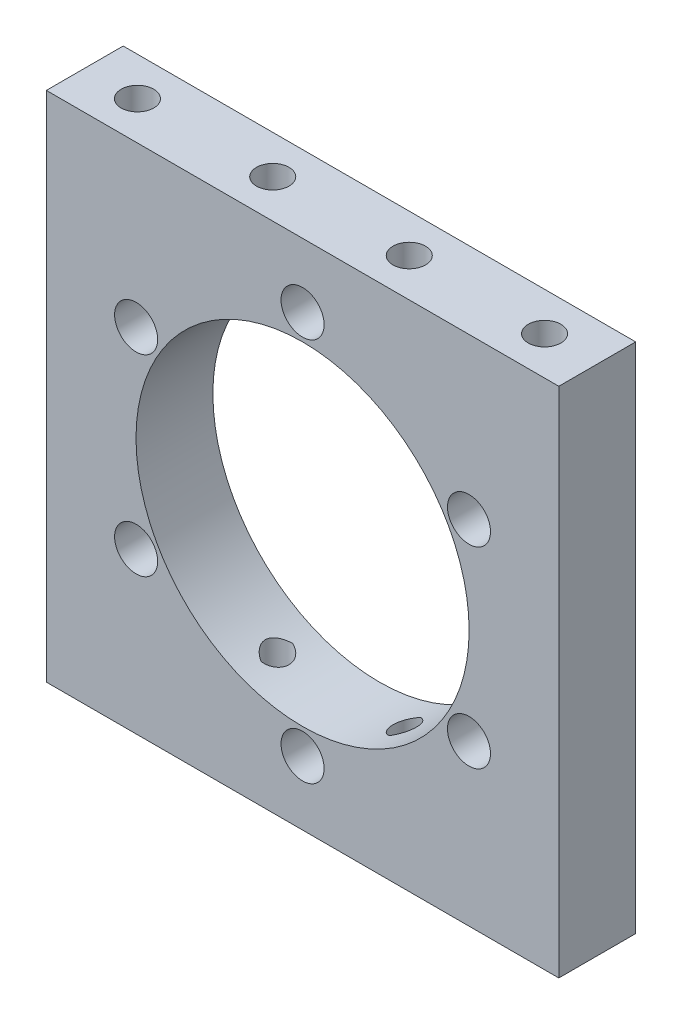
from build123d import *

# Parameters (mm, degrees)
SKETCH1_W                       = 63.5
SKETCH1_H                       = 63.5
BOSS_EXTRUDE1_DEPTH             = 9.525
SKETCH2_R                       = 20.6375
CUT_EXTRUDE1_DEPTH              = 46.900442536
F_10_32_TAPPED_HOLE1_AT_2_COUNT = 2
F_10_32_TAPPED_HOLE1_AT_2_PITCH = 16.9164
F_10_32_TAPPED_HOLE1_AT_3_COUNT = 2
F_10_32_TAPPED_HOLE1_AT_3_PITCH = 33.6804
F_10_32_TAPPED_HOLE1_AT_4_COUNT = 2
F_10_32_TAPPED_HOLE1_AT_4_PITCH = 16.764
F_10_0_1935_DIAMETER_HOLE1_D    = 5.334


with BuildPart() as part:
    # Sketch1 → Boss-Extrude1 (new body)
    with BuildSketch(Plane(origin=(0, 0, 0), x_dir=(-1, 0, 0), z_dir=(0, 0, -1))):
        Rectangle(SKETCH1_W, SKETCH1_H)
    extrude(amount=-BOSS_EXTRUDE1_DEPTH)

    # Sketch2 → Cut-Extrude1 (cut, through all)
    with BuildSketch(Plane.XY.offset(9.525)):
        Circle(SKETCH2_R)
    extrude(amount=-CUT_EXTRUDE1_DEPTH, mode=Mode.SUBTRACT)

    # Sketch3 → #10-32 Tapped Hole1 (revolve, cut)
    with BuildSketch(Plane(origin=(8.4582, -31.75, 4.7625), x_dir=(0, 0, -1), z_dir=(1, 0, 0))):
        Polygon((0, 0), (0, 13.913317848), (2.0193, 12.7), (2.0193, 0), align=None)
    f_10_32_tapped_hole1 = revolve(axis=Axis((8.4582, -38.1, 4.7625), (0, 1, 0)), mode=Mode.SUBTRACT)

    # #10-32 Tapped Hole1 at 2: #10-32 Tapped Hole1 ×2
    with Locations(*[(-i * F_10_32_TAPPED_HOLE1_AT_2_PITCH, 0, 0) for i in range(1, F_10_32_TAPPED_HOLE1_AT_2_COUNT)]):
        add(f_10_32_tapped_hole1, mode=Mode.SUBTRACT)

    # #10-32 Tapped Hole1 at 3: #10-32 Tapped Hole1 ×2
    with Locations(*[(-i * F_10_32_TAPPED_HOLE1_AT_3_PITCH, 0, 0) for i in range(1, F_10_32_TAPPED_HOLE1_AT_3_COUNT)]):
        add(f_10_32_tapped_hole1, mode=Mode.SUBTRACT)

    # #10-32 Tapped Hole1 at 4: #10-32 Tapped Hole1 ×2
    with Locations(*[(i * F_10_32_TAPPED_HOLE1_AT_4_PITCH, 0, 0) for i in range(1, F_10_32_TAPPED_HOLE1_AT_4_COUNT)]):
        add(f_10_32_tapped_hole1, mode=Mode.SUBTRACT)

    # #10 (0.1935) Diameter Hole1 (through all)
    with Locations(Plane(origin=(0, 0, 0), x_dir=(-1, 0, 0), z_dir=(0, 0, -1))):
        with Locations((-20.622229928, 11.90625), (-20.622229928, -11.90625), (0, -23.8125), (20.622229928, -11.90625), (20.622229928, 11.90625), (0, 23.8125)):
            Hole(F_10_0_1935_DIAMETER_HOLE1_D / 2)

    # Mirror1: #10-32 Tapped Hole1 across plane
    add(f_10_32_tapped_hole1.mirror(Plane.ZX), mode=Mode.SUBTRACT)

    # Mirror1 copy 1 sketch → Mirror1 copy 1 (revolve, cut)
    with BuildSketch(Plane(origin=(-8.4582, 31.75, 4.7625), x_dir=(0, 0, -1), z_dir=(1, 0, 0))):
        Polygon((0, 0), (0, -13.913317848), (2.0193, -12.7), (2.0193, 0), align=None)
    revolve(axis=Axis((-8.4582, 38.1, 4.7625), (0, 1, 0)), mode=Mode.SUBTRACT)

    # Mirror1 copy 2 sketch → Mirror1 copy 2 (revolve, cut)
    with BuildSketch(Plane(origin=(-25.2222, 31.75, 4.7625), x_dir=(0, 0, -1), z_dir=(1, 0, 0))):
        Polygon((0, 0), (0, -13.913317848), (2.0193, -12.7), (2.0193, 0), align=None)
    revolve(axis=Axis((-25.2222, 38.1, 4.7625), (0, 1, 0)), mode=Mode.SUBTRACT)

    # Mirror1 copy 3 sketch → Mirror1 copy 3 (revolve, cut)
    with BuildSketch(Plane(origin=(25.2222, 31.75, 4.7625), x_dir=(0, 0, -1), z_dir=(1, 0, 0))):
        Polygon((0, 0), (0, -13.913317848), (2.0193, -12.7), (2.0193, 0), align=None)
    revolve(axis=Axis((25.2222, 38.1, 4.7625), (0, 1, 0)), mode=Mode.SUBTRACT)


solid = part.part
